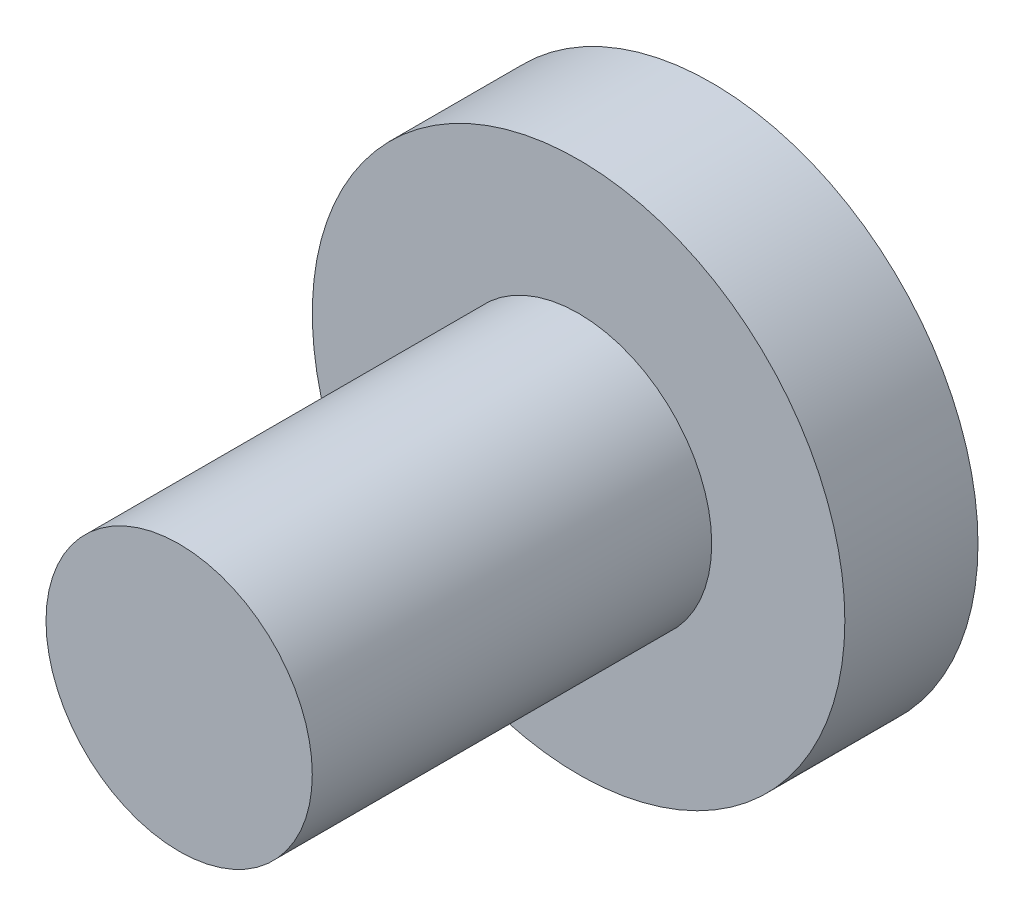
from build123d import *

# Parameters (mm, degrees)
SKETCH_1_R      = 10
EXTRUDE_1_DEPTH = 5
SKETCH_2_R      = 5
EXTRUDE_2_DEPTH = 15


with BuildPart() as part:
    # 草图1 → 凸台-拉伸1 (new body)
    with BuildSketch(Plane.XY):
        Circle(SKETCH_1_R)
    extrude(amount=EXTRUDE_1_DEPTH)

    # 草图2 → 凸台-拉伸2 (add)
    with BuildSketch(Plane.XY.offset(5)):
        Circle(SKETCH_2_R)
    extrude(amount=EXTRUDE_2_DEPTH)


solid = part.part
